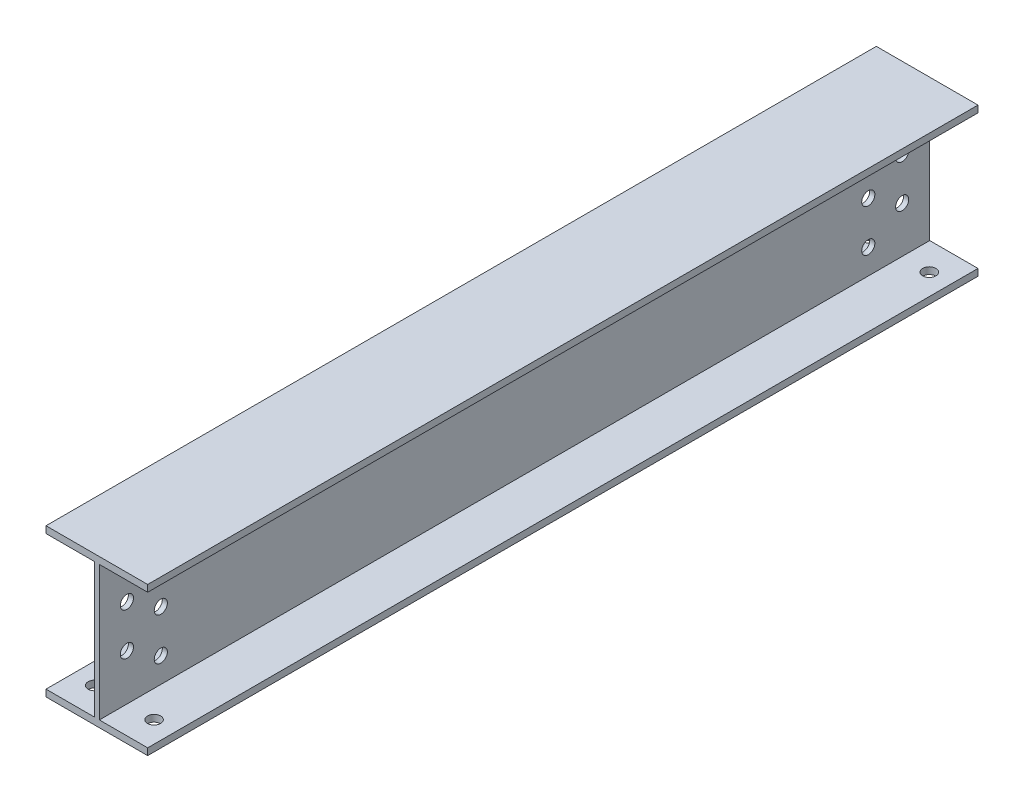
from build123d import *

# Parameters (mm, degrees)
EXTRUDE_1_DEPTH          = 980
CUT_EXTRUDE_2_DEPTH      = 1003.708831117
CUT_EXTRUDE_2_DEPTH_BACK = 1003.708831117
SKETCH_2_R               = 15.5
SKETCH_5_R               = 15.5
CUT_EXTRUDE_4_DEPTH      = 1043.284030387


with BuildPart() as part:
    # 草图1 → 拉伸1 (new, symmetric)
    with BuildSketch(Plane.XY):
        Polygon((-6, 159), (-120, 159), (-120, 175), (120, 175), (120, 159), (6, 159), (6, -159), (120, -159), (120, -175), (-120, -175), (-120, -159), (-6, -159), align=None)
    extrude(amount=EXTRUDE_1_DEPTH, both=True)

    # 草图2 → 拉伸2 (cut, two sides: drawn at the far end of the back side and taken through both)
    with BuildSketch(Plane(origin=(0, 0, 0), x_dir=(0, 0, -1), z_dir=(1, 0, 0)).offset(-CUT_EXTRUDE_2_DEPTH_BACK)):
        with Locations(Location((-915, 50, 0), (0, 0, 270))):
            Circle(SKETCH_2_R)
        with Locations(Location((-835, 100, 0), (0, 0, 270))):
            Circle(SKETCH_2_R)
        with Locations(Location((-835, 0, 0), (0, 0, 270))):
            Circle(SKETCH_2_R)
        with Locations(Location((-835, -100, 0), (0, 0, 270))):
            Circle(SKETCH_2_R)
        with Locations(Location((-915, -50, 0), (0, 0, 270))):
            Circle(SKETCH_2_R)
        with Locations(Location((915, -50, 0), (0, 0, 270))):
            Circle(SKETCH_2_R)
        with Locations(Location((835, -100, 0), (0, 0, 270))):
            Circle(SKETCH_2_R)
        with Locations(Location((835, 0, 0), (0, 0, 270))):
            Circle(SKETCH_2_R)
        with Locations(Location((835, 100, 0), (0, 0, 270))):
            Circle(SKETCH_2_R)
        with Locations(Location((915, 50, 0), (0, 0, 270))):
            Circle(SKETCH_2_R)
    extrude(amount=CUT_EXTRUDE_2_DEPTH + CUT_EXTRUDE_2_DEPTH_BACK, mode=Mode.SUBTRACT)

    # 草图5 → 拉伸4 (cut, through all)
    with BuildSketch(Plane(origin=(0, -159, 0), x_dir=(1, 0, 0), z_dir=(0, 1, 0))):
        with Locations(Location((-70, 915, 0), (0, 0, 270))):
            Circle(SKETCH_5_R)
        with Locations(Location((70, 915, 0), (0, 0, 270))):
            Circle(SKETCH_5_R)
        with Locations(Location((70, -915, 0), (0, 0, 90))):
            Circle(SKETCH_5_R)
        with Locations(Location((-70, -915, 0), (0, 0, 90))):
            Circle(SKETCH_5_R)
    extrude(amount=-CUT_EXTRUDE_4_DEPTH, mode=Mode.SUBTRACT)


solid = part.part
